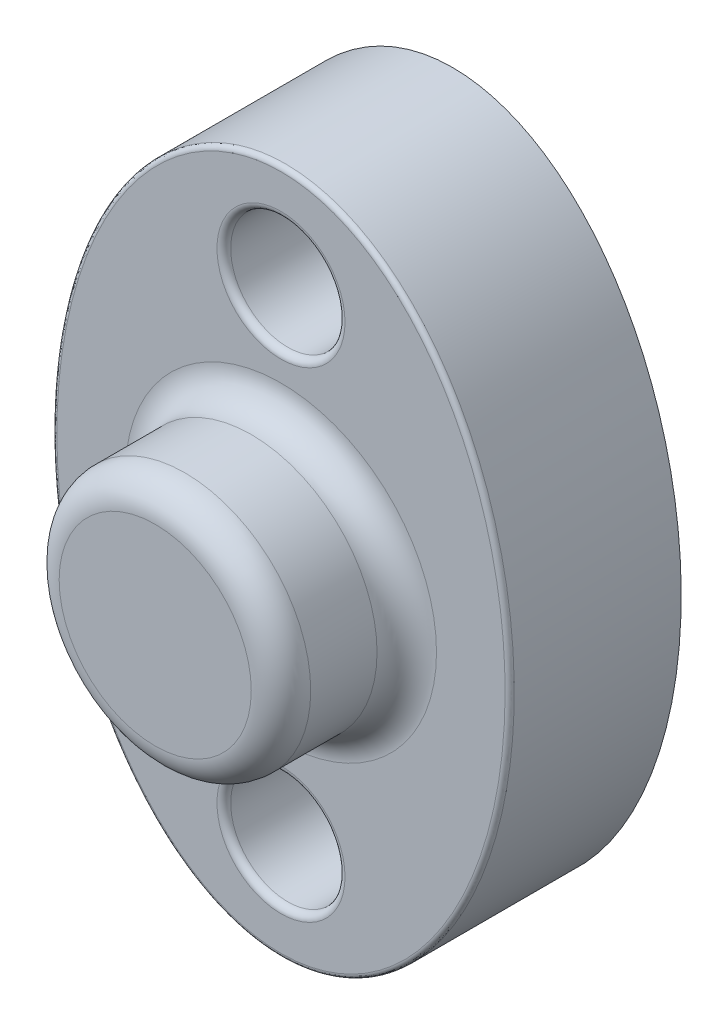
from build123d import *
from OCP.BRepFilletAPI import BRepFilletAPI_MakeFillet

# Parameters (mm, degrees)
ESQUISSE1_RX       = 15
ESQUISSE1_RY       = 10
ESQUISSE1_R        = 2.5
BOSS_EXTRU_1_DEPTH = 7.5
ESQUISSE3_R        = 5.5
BOSS_EXTRU_3_DEPTH = 5.5
CONG_2_R1          = 0.3
CONG_2_R2          = 1.3
CONG_2_R3          = 0.2


with BuildPart() as part:
    # Esquisse1 → Boss.-Extru.1 (new body)
    with BuildSketch(Plane.XY):
        with Locations(Location((0, 0), (0, 0, 90))):
            Ellipse(ESQUISSE1_RX, ESQUISSE1_RY)
        with Locations((0, 10.5)):
            Circle(ESQUISSE1_R, mode=Mode.SUBTRACT)
        with Locations((0, -10.5)):
            Circle(ESQUISSE1_R, mode=Mode.SUBTRACT)
    extrude(amount=BOSS_EXTRU_1_DEPTH)

    # Esquisse3 → Boss.-Extru.3 (add)
    with BuildSketch(Plane.XY.offset(7.5)):
        Circle(ESQUISSE3_R)
    extrude(amount=BOSS_EXTRU_3_DEPTH)

    # Congé2: one fillet with a radius per group of edges: ONE call of the kernel's fillet builder (fillet() takes one radius for all edges)
    cong_2_edges_1 = [part.edges().sort_by_distance(p)[0] for p in [
        (-2.5, 10.5, 7.5),
        (-2.5, -10.5, 7.5),
    ]]
    cong_2_edges_2 = [part.edges().sort_by_distance(p)[0] for p in [
        (-5.5, 0, 13),
        (-5.5, 0, 7.5),
    ]]
    cong_2_edges_3 = [part.edges().sort_by_distance(p)[0] for p in [
        (0.0106478, -14.999991497, 7.5),
    ]]
    cong_2 = BRepFilletAPI_MakeFillet(part.part.solid().wrapped)
    for e in cong_2_edges_1:
        cong_2.Add(CONG_2_R1, e.wrapped)
    for e in cong_2_edges_2:
        cong_2.Add(CONG_2_R2, e.wrapped)
    for e in cong_2_edges_3:
        cong_2.Add(CONG_2_R3, e.wrapped)
    add(Compound.cast(cong_2.Shape()), mode=Mode.REPLACE)


solid = part.part
